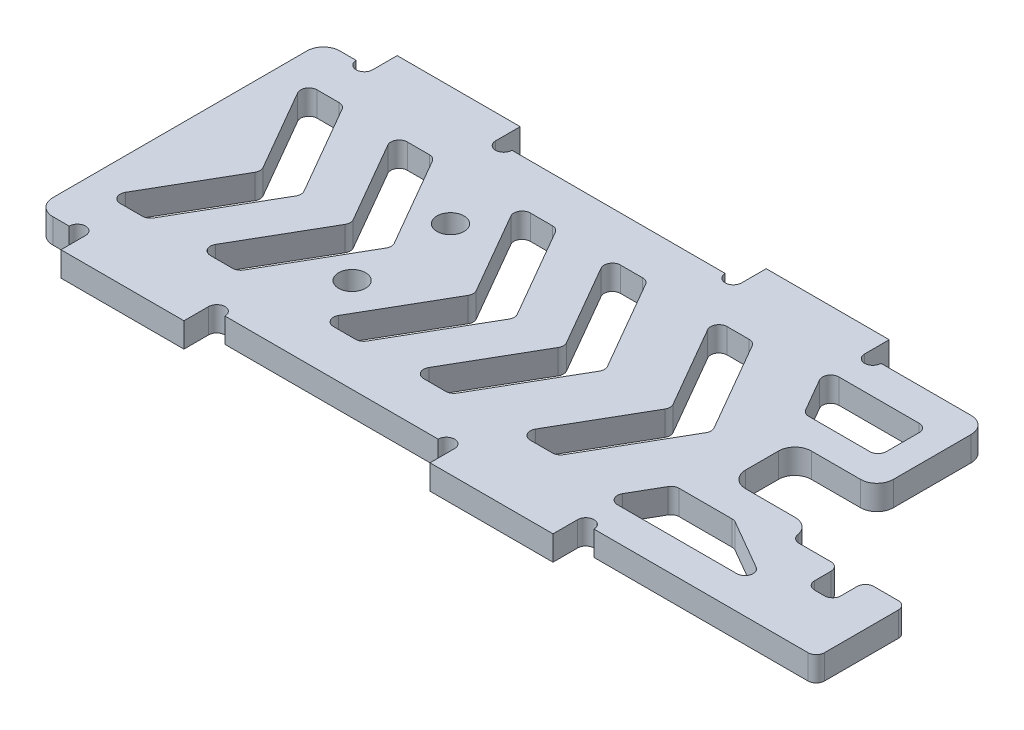
from build123d import *

# Parameters (mm, degrees)
SKETCH_1_R          = 1.65
EXTRUDE_1_DEPTH     = 3
CUT_EXTRUDE_1_DEPTH = 3
FILLET_1_R          = 2
SKETCH_3_R          = 1
CUT_EXTRUDE_2_DEPTH = 3
CUT_EXTRUDE_3_DEPTH = 3


with BuildPart() as part:
    # 草图1 → 凸台-拉伸1 (new body)
    with BuildSketch(Plane(origin=(0, 0, 0), x_dir=(1, 0, 0), z_dir=(0, 1, 0))):
        with BuildLine():
            Line((-30, 20.5), (-15, 20.5))
            Line((-15, 20.5), (-15, 17.5))
            Line((-15, 17.5), (15, 17.5))
            Line((15, 17.5), (15, 20.5))
            Line((15, 20.5), (30, 20.5))
            Line((30, 20.5), (30, 17.5))
            Line((30, 17.5), (43, 17.5))
            ThreePointArc((43, 17.5), (44.414213562, 16.914213562), (45, 15.5))
            Line((45, 15.5), (45, -5.5))
            ThreePointArc((45, -5.5), (45.292893219, -6.207106781), (46, -6.5))
            Line((46, -6.5), (49.9, -6.5))
            ThreePointArc((49.9, -6.5), (50.607106781, -6.792893219), (50.9, -7.5))
            Line((50.9, -7.5), (50.9, -9.5))
            ThreePointArc((50.9, -9.5), (51.192893219, -10.207106781), (51.9, -10.5))
            Line((51.9, -10.5), (53.1, -10.5))
            ThreePointArc((53.1, -10.5), (53.807106781, -10.207106781), (54.1, -9.5))
            Line((54.1, -9.5), (54.1, -7.5))
            ThreePointArc((54.1, -7.5), (54.392893219, -6.792893219), (55.1, -6.5))
            Line((55.1, -6.5), (58.1, -6.5))
            ThreePointArc((58.1, -6.5), (58.807106781, -6.792893219), (59.1, -7.5))
            Line((59.1, -7.5), (59.1, -16.5))
            ThreePointArc((59.1, -16.5), (58.807106781, -17.207106781), (58.1, -17.5))
            Line((58.1, -17.5), (30, -17.5))
            Line((30, -17.5), (30, -20.5))
            Line((30, -20.5), (15, -20.5))
            Line((15, -20.5), (15, -17.5))
            Line((15, -17.5), (-15, -17.5))
            Line((-15, -17.5), (-15, -20.5))
            Line((-15, -20.5), (-30, -20.5))
            Line((-30, -20.5), (-30, -17.5))
            Line((-30, -17.5), (-34, -17.5))
            ThreePointArc((-34, -17.5), (-35.414213562, -16.914213562), (-36, -15.5))
            Line((-36, -15.5), (-36, 15.5))
            ThreePointArc((-36, 15.5), (-35.414213562, 16.914213562), (-34, 17.5))
            Line((-34, 17.5), (-30, 17.5))
            Line((-30, 17.5), (-30, 20.5))
        make_face()
        with Locations(Location((-9, 6, 0), (0, 0, 270))):
            Circle(SKETCH_1_R, mode=Mode.SUBTRACT)
        with Locations(Location((-9, -6, 0), (0, 0, 270))):
            Circle(SKETCH_1_R, mode=Mode.SUBTRACT)
    extrude(amount=EXTRUDE_1_DEPTH)

    # 草图2 → 切除-拉伸1 (cut)
    with BuildSketch(Plane(origin=(0, 3, 0), x_dir=(1, 0, 0), z_dir=(0, 1, 0))):
        with BuildLine():
            Line((37, -4), (45, -4))
            Line((45, -4), (45, 4))
            Line((45, 4), (37, 4))
            ThreePointArc((37, 4), (35.585786438, 3.414213562), (35, 2))
            Line((35, 2), (35, -2))
            ThreePointArc((35, -2), (35.585786438, -3.414213562), (37, -4))
        make_face()
    extrude(amount=-CUT_EXTRUDE_1_DEPTH, mode=Mode.SUBTRACT)

    # 圆角1
    fillet_1_edges = [part.edges().sort_by_distance(p)[0] for p in [
        (45, 1.5, 4),
        (45, 1.5, -4),
    ]]
    fillet(fillet_1_edges, radius=FILLET_1_R)

    # 草图3 → 切除-拉伸2 (cut)
    with BuildSketch(Plane(origin=(0, 3, 0), x_dir=(1, 0, 0), z_dir=(0, 1, 0))):
        with Locations((-31, 17.5)):
            Circle(SKETCH_3_R)
        with Locations((-14, 17.5)):
            Circle(SKETCH_3_R)
        with Locations((14, 17.5)):
            Circle(SKETCH_3_R)
        with Locations((31, 17.5)):
            Circle(SKETCH_3_R)
        with Locations((-31, -17.5)):
            Circle(SKETCH_3_R)
        with Locations((-14, -17.5)):
            Circle(SKETCH_3_R)
        with Locations((14, -17.5)):
            Circle(SKETCH_3_R)
        with Locations((31, -17.5)):
            Circle(SKETCH_3_R)
    extrude(amount=-CUT_EXTRUDE_2_DEPTH, mode=Mode.SUBTRACT)

    # 草图4 → 切除-拉伸3 (cut)
    with BuildSketch(Plane(origin=(0, 3, 0), x_dir=(1, 0, 0), z_dir=(0, 1, 0))):
        with BuildLine():
            Line((-15.360471904, 0.5), (-21.133974596, 10.5))
            ThreePointArc((-21.133974596, 10.5), (-21.133974596, 11.5), (-20.267949192, 12))
            Line((-20.267949192, 12), (-17.577350269, 12))
            ThreePointArc((-17.577350269, 12), (-17.077350269, 11.866025404), (-16.711324865, 11.5))
            Line((-16.711324865, 11.5), (-10.360471904, 0.5))
            ThreePointArc((-10.360471904, 0.5), (-10.226497308, 0), (-10.360471904, -0.5))
            Line((-10.360471904, -0.5), (-16.711324865, -11.5))
            ThreePointArc((-16.711324865, -11.5), (-17.077350269, -11.866025404), (-17.577350269, -12))
            Line((-17.577350269, -12), (-20.267949192, -12))
            ThreePointArc((-20.267949192, -12), (-21.133974596, -11.5), (-21.133974596, -10.5))
            Line((-21.133974596, -10.5), (-15.360471904, -0.5))
            ThreePointArc((-15.360471904, -0.5), (-15.226497308, 0), (-15.360471904, 0.5))
        make_face()
        with BuildLine():
            Line((-31.267949192, 12), (-28.577350269, 12))
            ThreePointArc((-28.577350269, 12), (-28.077350269, 11.866025404), (-27.711324865, 11.5))
            Line((-27.711324865, 11.5), (-21.360471904, 0.5))
            ThreePointArc((-21.360471904, 0.5), (-21.226497308, 0), (-21.360471904, -0.5))
            Line((-21.360471904, -0.5), (-27.711324865, -11.5))
            ThreePointArc((-27.711324865, -11.5), (-28.077350269, -11.866025404), (-28.577350269, -12))
            Line((-28.577350269, -12), (-31.267949192, -12))
            ThreePointArc((-31.267949192, -12), (-32.133974596, -11.5), (-32.133974596, -10.5))
            Line((-32.133974596, -10.5), (-26.360471904, -0.5))
            ThreePointArc((-26.360471904, -0.5), (-26.226497308, 0), (-26.360471904, 0.5))
            Line((-26.360471904, 0.5), (-32.133974596, 10.5))
            ThreePointArc((-32.133974596, 10.5), (-32.133974596, 11.5), (-31.267949192, 12))
        make_face()
        with BuildLine():
            Line((10.639528096, 0.5), (4.866025404, 10.5))
            ThreePointArc((4.866025404, 10.5), (4.866025404, 11.5), (5.732050808, 12))
            Line((5.732050808, 12), (8.422649731, 12))
            ThreePointArc((8.422649731, 12), (8.922649731, 11.866025404), (9.288675135, 11.5))
            Line((9.288675135, 11.5), (15.639528096, 0.5))
            ThreePointArc((15.639528096, 0.5), (15.773502692, 0), (15.639528096, -0.5))
            Line((15.639528096, -0.5), (9.288675135, -11.5))
            ThreePointArc((9.288675135, -11.5), (8.922649731, -11.866025404), (8.422649731, -12))
            Line((8.422649731, -12), (5.732050808, -12))
            ThreePointArc((5.732050808, -12), (4.866025404, -11.5), (4.866025404, -10.5))
            Line((4.866025404, -10.5), (10.639528096, -0.5))
            ThreePointArc((10.639528096, -0.5), (10.773502692, 0), (10.639528096, 0.5))
        make_face()
        with BuildLine():
            Line((-0.360471904, 0.5), (-6.133974596, 10.5))
            ThreePointArc((-6.133974596, 10.5), (-6.133974596, 11.5), (-5.267949192, 12))
            Line((-5.267949192, 12), (-2.577350269, 12))
            ThreePointArc((-2.577350269, 12), (-2.077350269, 11.866025404), (-1.711324865, 11.5))
            Line((-1.711324865, 11.5), (4.639528096, 0.5))
            ThreePointArc((4.639528096, 0.5), (4.773502692, 0), (4.639528096, -0.5))
            Line((4.639528096, -0.5), (-1.711324865, -11.5))
            ThreePointArc((-1.711324865, -11.5), (-2.077350269, -11.866025404), (-2.577350269, -12))
            Line((-2.577350269, -12), (-5.267949192, -12))
            ThreePointArc((-5.267949192, -12), (-6.133974596, -11.5), (-6.133974596, -10.5))
            Line((-6.133974596, -10.5), (-0.360471904, -0.5))
            ThreePointArc((-0.360471904, -0.5), (-0.226497308, 0), (-0.360471904, 0.5))
        make_face()
        with BuildLine():
            Line((23.639528096, 0.5), (17.866025404, 10.5))
            ThreePointArc((17.866025404, 10.5), (17.866025404, 11.5), (18.732050808, 12))
            Line((18.732050808, 12), (21.422649731, 12))
            ThreePointArc((21.422649731, 12), (21.922649731, 11.866025404), (22.288675135, 11.5))
            Line((22.288675135, 11.5), (28.639528096, 0.5))
            ThreePointArc((28.639528096, 0.5), (28.773502692, 0), (28.639528096, -0.5))
            Line((28.639528096, -0.5), (22.288675135, -11.5))
            ThreePointArc((22.288675135, -11.5), (21.922649731, -11.866025404), (21.422649731, -12))
            Line((21.422649731, -12), (18.732050808, -12))
            ThreePointArc((18.732050808, -12), (17.866025404, -11.5), (17.866025404, -10.5))
            Line((17.866025404, -10.5), (23.639528096, -0.5))
            ThreePointArc((23.639528096, -0.5), (23.773502692, 0), (23.639528096, 0.5))
        make_face()
        with BuildLine():
            Line((30.866025404, 13.5), (40.639528096, 13.5))
            ThreePointArc((40.639528096, 13.5), (41.346634877, 13.207106781), (41.639528096, 12.5))
            Line((41.639528096, 12.5), (41.639528096, 8.5))
            ThreePointArc((41.639528096, 8.5), (41.346634877, 7.792893219), (40.639528096, 7.5))
            Line((40.639528096, 7.5), (33.175426481, 7.5))
            ThreePointArc((33.175426481, 7.5), (32.675426481, 7.633974596), (32.309401077, 8))
            Line((32.309401077, 8), (30, 12))
            ThreePointArc((30, 12), (30, 13), (30.866025404, 13.5))
        make_face()
        with BuildLine():
            Line((32.886751346, -8), (39.339745962, -8))
            ThreePointArc((39.339745962, -8), (39.598565007, -8.034074174), (39.839745962, -8.133974596))
            Line((39.839745962, -8.133974596), (45.901923789, -11.633974596))
            ThreePointArc((45.901923789, -11.633974596), (46.367849615, -12.758819045), (45.401923789, -13.5))
            Line((45.401923789, -13.5), (30.866025404, -13.5))
            ThreePointArc((30.866025404, -13.5), (30, -13), (30, -12))
            Line((30, -12), (32.020725942, -8.5))
            ThreePointArc((32.020725942, -8.5), (32.386751346, -8.133974596), (32.886751346, -8))
        make_face()
    extrude(amount=-CUT_EXTRUDE_3_DEPTH, mode=Mode.SUBTRACT)


solid = part.part
